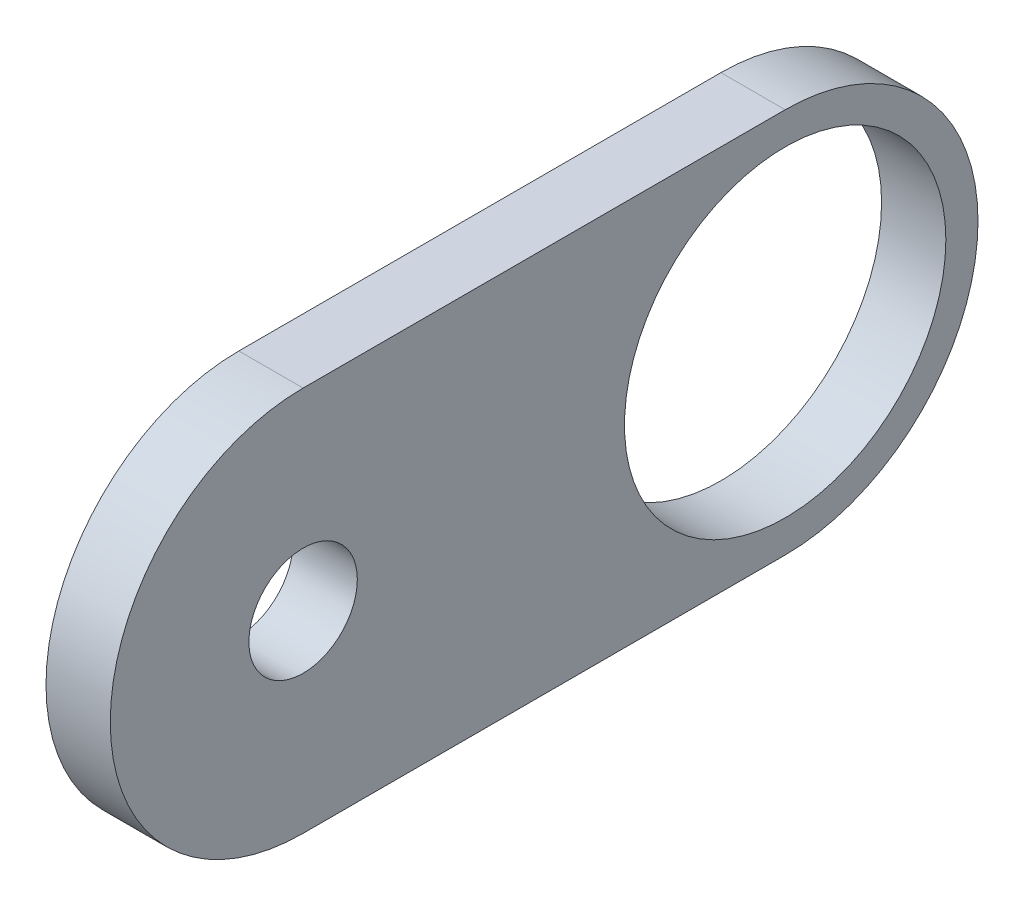
from build123d import *

# Parameters (mm, degrees)
SKETCH1_R           = 12.7
SKETCH1_R_2         = 4.28498
BOSS_EXTRUDE1_DEPTH = 5.079999975


with BuildPart() as part:
    # Sketch1 → Boss-Extrude1 (new body)
    with BuildSketch(Plane.YZ):
        with BuildLine():
            Line((-60.873619371, 15.361912765), (-60.873619371, -22.738087235))
            ThreePointArc((-60.873619371, -22.738087235), (-45.633619371, -37.978087235), (-30.393619371, -22.738087235))
            Line((-30.393619371, -22.738087235), (-30.393619371, 15.361912765))
            ThreePointArc((-30.393619371, 15.361912765), (-45.633619371, 30.601912765), (-60.873619371, 15.361912765))
        make_face()
        with Locations(Location((-45.633619371, -22.738087235, 0), (0, 0, 270))):
            Circle(SKETCH1_R, mode=Mode.SUBTRACT)
        with Locations(Location((-45.633619371, 15.361912765, 0), (0, 0, 270))):
            Circle(SKETCH1_R_2, mode=Mode.SUBTRACT)
    extrude(amount=BOSS_EXTRUDE1_DEPTH)


solid = part.part
